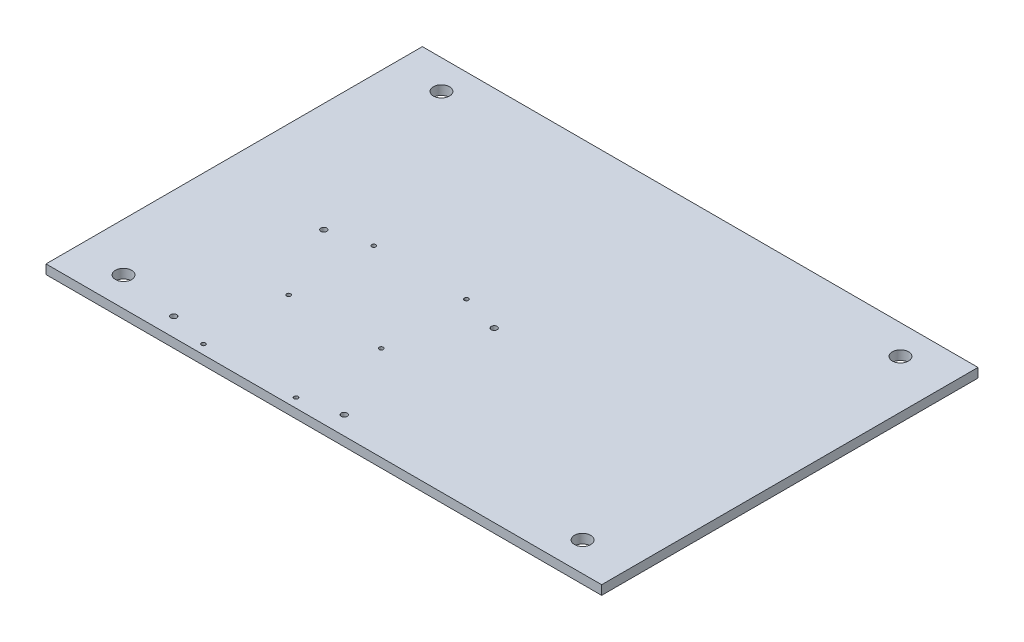
from build123d import *

# Parameters (mm, degrees)
SKETCH1_W                           = 300
SKETCH1_H                           = 203.2
BOSS_EXTRUDE1_DEPTH                 = 5
SKETCH2_R                           = 3.2639
HOLES_FOR_MOUNTING_TO_CHAMBER_DEPTH = 363.374447223
CLEARANCE_HOLES_FOR_LED_PANEL_D     = 2.2
M3_CLEARANCE_HOLE1_D                = 3.2
HOLE_FOR_1_4_300_SC_NUTS_SP_1_D     = 8.7376
HOLE_FOR_1_4_300_SC_NUTS_SP_1_DEPTH = 31.75
HOLE_FOR_1_4_300_SC_NUTS_SP_1_TIP   = 2.625039872


with BuildPart() as part:
    # Sketch1 → Boss-Extrude1 (new body)
    with BuildSketch(Plane(origin=(0, 0, 0), x_dir=(1, 0, 0), z_dir=(0, 1, 0))):
        with Locations((150, -101.6)):
            Rectangle(SKETCH1_W, SKETCH1_H)
    extrude(amount=BOSS_EXTRUDE1_DEPTH)

    # Sketch2 → holes for mounting to chamber (cut, through all)
    with BuildSketch(Plane(origin=(0, 5, 0), x_dir=(1, 0, 0), z_dir=(0, 1, 0))):
        with Locations(Location((26.0861, -15.7861, 0), (0, 0, 270))):
            Circle(SKETCH2_R)
        with Locations(Location((273.9139, -15.7861, 0), (0, 0, 90))):
            Circle(SKETCH2_R)
        with Locations(Location((273.9139, -187.4139, 0), (0, 0, 270))):
            Circle(SKETCH2_R)
        with Locations(Location((26.0861, -187.4139, 0), (0, 0, 90))):
            Circle(SKETCH2_R)
    extrude(amount=-HOLES_FOR_MOUNTING_TO_CHAMBER_DEPTH, mode=Mode.SUBTRACT)

    # clearance holes for led panel (through all)
    with Locations(Plane(origin=(0, 5, 0), x_dir=(1, 0, 0), z_dir=(0, 1, 0))):
        with Locations((80, -106.2), (130, -106.2), (130, -152.2), (80, -152.2), (80, -198.2), (130, -198.2)):
            Hole(CLEARANCE_HOLES_FOR_LED_PANEL_D / 2)

    # M3 Clearance Hole1 (through all)
    with Locations(Plane(origin=(0, 5, 0), x_dir=(1, 0, 0), z_dir=(0, 1, 0))):
        with Locations((59, -112.2), (151, -112.2), (151, -193.2), (59, -193.2)):
            Hole(M3_CLEARANCE_HOLE1_D / 2)

    # Hole for 1/4 300® SC Nuts (SP)1
    with Locations(Plane(origin=(0, 5, 0), x_dir=(1, 0, 0), z_dir=(0, 1, 0))):
        with Locations((26.0861, -15.7861), (273.9139, -15.7861), (273.9139, -187.4139), (26.0861, -187.4139)):
            Hole(HOLE_FOR_1_4_300_SC_NUTS_SP_1_D / 2, depth=HOLE_FOR_1_4_300_SC_NUTS_SP_1_DEPTH)
            with Locations((0, 0, -(HOLE_FOR_1_4_300_SC_NUTS_SP_1_DEPTH + HOLE_FOR_1_4_300_SC_NUTS_SP_1_TIP / 2))):  # 118° drill point
                Cone(0, HOLE_FOR_1_4_300_SC_NUTS_SP_1_D / 2, HOLE_FOR_1_4_300_SC_NUTS_SP_1_TIP, mode=Mode.SUBTRACT)


solid = part.part
